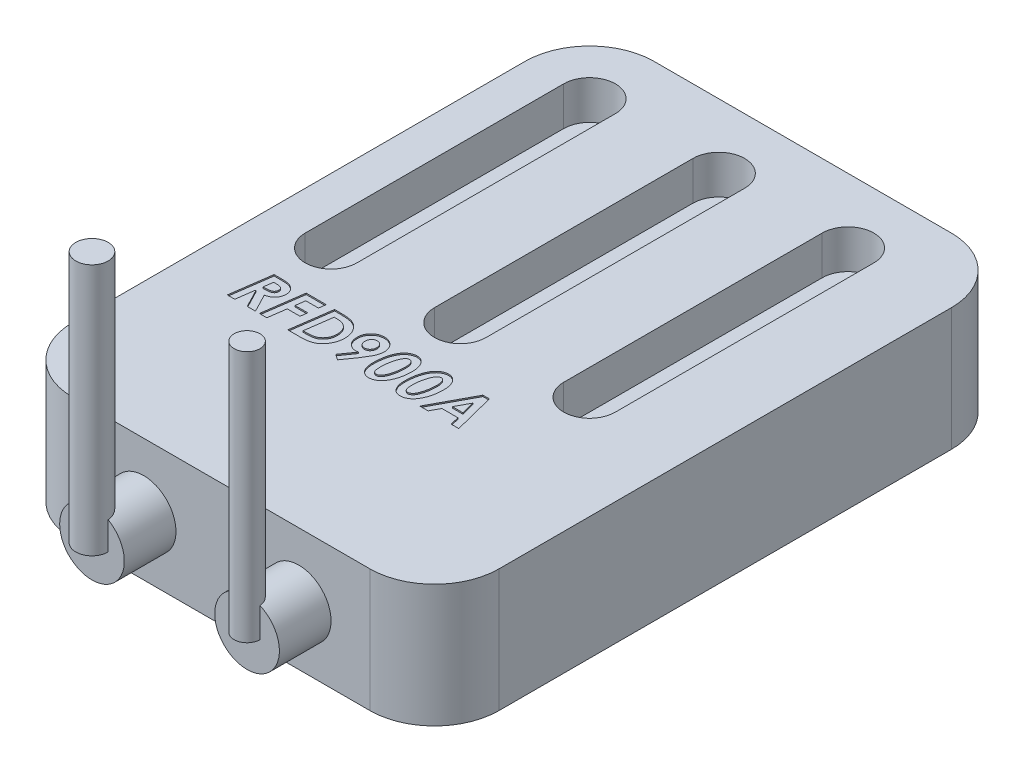
from build123d import *

# Parameters (mm, degrees)
SKETCH1_W           = 33
SKETCH1_H           = 45
BOSS_EXTRUDE1_DEPTH = 9.5
FILLET1_R           = 5
SKETCH2_R           = 2.5
BOSS_EXTRUDE2_DEPTH = 4
CUT_EXTRUDE1_DEPTH  = 3
CUT_EXTRUDE2_DEPTH  = 0.1
SWEEP1_PROFILE_R    = 1.25
SWEEP2_PROFILE_R    = 1


with BuildPart() as part:
    # Sketch1 → Boss-Extrude1 (new body)
    with BuildSketch(Plane(origin=(0, 0, 0), x_dir=(1, 0, 0), z_dir=(0, 1, 0))):
        Rectangle(SKETCH1_W, SKETCH1_H)
    extrude(amount=BOSS_EXTRUDE1_DEPTH)

    # Fillet1
    fillet1_edges = [part.edges().sort_by_distance(p)[0] for p in [
        (16.5, 4.75, 22.5),
        (-16.5, 4.75, 22.5),
        (-16.5, 4.75, -22.5),
        (16.5, 4.75, -22.5),
    ]]
    fillet(fillet1_edges, radius=FILLET1_R)

    # Sketch2 → Boss-Extrude2 (add)
    with BuildSketch(Plane.XY.offset(22.5)):
        with Locations(Location((6, 4.5, 0), (0, 0, 180))):
            Circle(SKETCH2_R)
        with Locations(Location((-6, 4.5, 0), (0, 0, 180))):
            Circle(SKETCH2_R)
    extrude(amount=BOSS_EXTRUDE2_DEPTH)

    # Sketch3 → Cut-Extrude1 (cut)
    with BuildSketch(Plane(origin=(0, 9.5, 0), x_dir=(1, 0, 0), z_dir=(0, 1, 0))):
        with BuildLine():
            Line((-9.5, 17.5), (-9.5, -2.5))
            ThreePointArc((-9.5, -2.5), (-11.5, -4.5), (-13.5, -2.5))
            Line((-13.5, -2.5), (-13.5, 17.5))
            ThreePointArc((-13.5, 17.5), (-11.5, 19.5), (-9.5, 17.5))
        make_face()
        with BuildLine():
            Line((-3.5, 17.5), (-3.5, -2.5))
            ThreePointArc((-3.5, -2.5), (-1.5, -4.5), (0.5, -2.5))
            Line((0.5, -2.5), (0.5, 17.5))
            ThreePointArc((0.5, 17.5), (-1.5, 19.5), (-3.5, 17.5))
        make_face()
        with BuildLine():
            Line((6.5, 17.5), (6.5, -2.5))
            ThreePointArc((6.5, -2.5), (8.5, -4.5), (10.5, -2.5))
            Line((10.5, -2.5), (10.5, 17.5))
            ThreePointArc((10.5, 17.5), (8.5, 19.5), (6.5, 17.5))
        make_face()
    extrude(amount=-CUT_EXTRUDE1_DEPTH, mode=Mode.SUBTRACT)

    # Sketch4 → Cut-Extrude2 (cut)
    # profile 1 of 7: a face of its own
    with BuildSketch(Plane(origin=(0, 9.5, 0), x_dir=(1, 0, 0), z_dir=(0, 1, 0))):
        with BuildLine():
            Line((-11.922359857, -6.486440114), (-11.370932573, -6.486440114))
            add(Edge.make_bspline(
                [(-11.370932573, -6.486440114), (-11.330010708, -6.486607344), (-11.251108431, -6.486929783), (-11.13764439, -6.49151487), (-11.033503704, -6.498432354), (-10.9388102, -6.507561343), (-10.853484818, -6.520227306), (-10.777704999, -6.535435331), (-10.710986719, -6.552371586), (-10.670976001, -6.568109859), (-10.652232653, -6.575482582)],
                knots=[0, 0, 0, 0, 1.348808202, 2.600664361, 3.742342956, 4.788858012, 5.735658768, 6.584006912, 7.336666444, 8, 8, 8, 8], degree=3))
            add(Edge.make_bspline(
                [(-10.652232653, -6.575482582), (-10.631130054, -6.584998846), (-10.589877811, -6.603601637), (-10.530765752, -6.635134509), (-10.47541191, -6.66910397), (-10.424733674, -6.70679078), (-10.377661579, -6.746608069), (-10.334487513, -6.788934552), (-10.295559118, -6.834419809), (-10.260467848, -6.882248003), (-10.229264842, -6.932357274), (-10.202480277, -6.984994725), (-10.179320127, -7.039714713), (-10.16123397, -7.097112688), (-10.146202199, -7.156499652), (-10.136480195, -7.218250296), (-10.129638307, -7.282156324), (-10.129076113, -7.325540164), (-10.128790145, -7.347607982)],
                knots=[0, 0, 0, 0, 1.116361014, 2.182309107, 3.229450697, 4.24598407, 5.225421932, 6.201651319, 7.158895679, 8.110002388, 9.060669178, 10.002827475, 10.956240434, 11.923213192, 12.902917952, 13.908279153, 14.936015885, 16, 16, 16, 16], degree=3))
            add(Edge.make_bspline(
                [(-10.128790145, -7.347607982), (-10.12946267, -7.374763952), (-10.130790343, -7.428374233), (-10.139465636, -7.507429804), (-10.155646136, -7.583291832), (-10.177436389, -7.656199289), (-10.204432763, -7.726624243), (-10.23924812, -7.793341246), (-10.279490342, -7.857512761), (-10.325966003, -7.918297458), (-10.377913743, -7.976252939), (-10.437895183, -8.027968457), (-10.502592063, -8.076922028), (-10.574662225, -8.119831532), (-10.652123559, -8.159690639), (-10.736742849, -8.193461698), (-10.826931924, -8.224627172), (-10.890170859, -8.240225058), (-10.922540145, -8.248208944)],
                knots=[0, 0, 0, 0, 0.995453645, 1.965186658, 2.910129054, 3.83459069, 4.752398018, 5.669942118, 6.588407184, 7.525617038, 8.471772905, 9.435289717, 10.423772802, 11.441988612, 12.505459691, 13.613754905, 14.778583949, 16, 16, 16, 16], degree=3))
            Line((-10.922540145, -8.248208944), (-10.189847838, -9.661440114))
            Line((-10.189847838, -9.661440114), (-10.826501484, -9.661440114))
            Line((-10.826501484, -9.661440114), (-11.543929368, -8.277465755))
            Line((-11.543929368, -8.277465755), (-11.597990867, -8.277465755))
            Line((-11.597990867, -8.277465755), (-11.792612261, -9.661440114))
            Line((-11.792612261, -9.661440114), (-12.367572197, -9.661440114))
            Line((-12.367572197, -9.661440114), (-11.922359857, -6.486440114))
        make_face()
        with BuildLine():
            add(Edge.make_bspline(
                [(-11.523576804, -7.748299088), (-11.482653708, -7.747919095), (-11.404378122, -7.747192265), (-11.292585111, -7.742136628), (-11.191773605, -7.73415056), (-11.102234346, -7.722737946), (-11.023731797, -7.709240955), (-10.956599441, -7.692390924), (-10.900529573, -7.672356545), (-10.85463783, -7.648597772), (-10.817462357, -7.620702654), (-10.785285388, -7.590934192), (-10.758492272, -7.557611694), (-10.73638555, -7.521294575), (-10.719335365, -7.481907561), (-10.707039545, -7.43918381), (-10.700241088, -7.393408187), (-10.699195971, -7.361833738), (-10.69866194, -7.34569993)],
                knots=[0, 0, 0, 0, 1.892208387, 3.619318591, 5.173427176, 6.566868293, 7.791773198, 8.8545744, 9.763297566, 10.539470204, 11.233547833, 11.906251103, 12.5615143, 13.203742025, 13.866659999, 14.539934446, 15.25394049, 16, 16, 16, 16], degree=3))
            add(Edge.make_bspline(
                [(-10.69866194, -7.34569993), (-10.699353222, -7.32740652), (-10.700694214, -7.291919814), (-10.712293245, -7.240808723), (-10.732127189, -7.194444022), (-10.760001095, -7.153268977), (-10.79478623, -7.116962861), (-10.837222189, -7.087060587), (-10.886824069, -7.063521744), (-10.933289199, -7.047970344), (-10.97727088, -7.038962574), (-11.018270281, -7.03291056), (-11.066812427, -7.027070582), (-11.123043329, -7.022752102), (-11.186895392, -7.019895508), (-11.258336106, -7.017119713), (-11.337221346, -7.016132624), (-11.39234531, -7.015787367), (-11.421177966, -7.01560678)],
                knots=[0, 0, 0, 0, 0.974340854, 1.890087692, 2.776057671, 3.647490651, 4.526730822, 5.442477659, 6.397820337, 7.445016909, 8.045730266, 8.789007992, 9.653967296, 10.651691253, 11.794598421, 13.061237498, 14.462876682, 16, 16, 16, 16], degree=3))
            Line((-11.421177966, -7.01560678), (-11.523576804, -7.748299088))
        make_face(mode=Mode.SUBTRACT)
    # profile 2 of 7: a face of its own
    with BuildSketch(Plane(origin=(0, 9.5, 0), x_dir=(1, 0, 0), z_dir=(0, 1, 0))):
        Polygon((-9.439347036, -6.486440114), (-7.890008094, -6.486440114), (-7.959334016, -7.01560678), (-8.938165145, -7.01560678), (-9.041200001, -7.748299088), (-8.05473666, -7.748299088), (-8.124062581, -8.277465755), (-9.114978046, -8.277465755), (-9.30959944, -9.661440114), (-9.884559376, -9.661440114), align=None)
    # profile 3 of 7: a face of its own
    with BuildSketch(Plane(origin=(0, 9.5, 0), x_dir=(1, 0, 0), z_dir=(0, 1, 0))):
        with BuildLine():
            Line((-7.241270113, -6.486440114), (-6.740088222, -6.486440114))
            add(Edge.make_bspline(
                [(-6.740088222, -6.486440114), (-6.683262698, -6.486909443), (-6.573373167, -6.487817034), (-6.414014068, -6.49530035), (-6.266114975, -6.508508655), (-6.129405265, -6.526789867), (-6.003873825, -6.550113444), (-5.88947271, -6.578355357), (-5.7860879, -6.611766449), (-5.693431313, -6.65191078), (-5.608116558, -6.696958499), (-5.528164918, -6.74836012), (-5.452199352, -6.805473692), (-5.379707582, -6.867937833), (-5.312159043, -6.937124595), (-5.248603147, -7.012304714), (-5.18879662, -7.093315214), (-5.132941226, -7.179315092), (-5.082698791, -7.27024386), (-5.038808147, -7.365282468), (-5.001125324, -7.463529598), (-4.971320338, -7.565524573), (-4.947758606, -7.670689068), (-4.930630637, -7.779433046), (-4.920175134, -7.891620208), (-4.919085278, -7.967490558), (-4.918533735, -8.005886228)],
                knots=[0, 0, 0, 0, 1.508928034, 2.917973822, 4.235011166, 5.450779055, 6.579221784, 7.623755204, 8.577985451, 9.460610614, 10.301756591, 11.137250569, 11.981705789, 12.823774396, 13.675702816, 14.546470419, 15.435981066, 16.347923198, 17.267651715, 18.192054867, 19.125737078, 20.059147693, 21.011116727, 21.985721956, 22.980635317, 24, 24, 24, 24], degree=3))
            add(Edge.make_bspline(
                [(-4.918533735, -8.005886228), (-4.919308689, -8.045555112), (-4.920849017, -8.12440256), (-4.93190154, -8.241244554), (-4.949775687, -8.355720348), (-4.974413313, -8.467790161), (-5.006861897, -8.577498694), (-5.047377488, -8.684267914), (-5.093510034, -8.789165744), (-5.147721737, -8.890034876), (-5.206185655, -8.986884778), (-5.269483358, -9.07744324), (-5.335872266, -9.161612524), (-5.407021726, -9.23823792), (-5.48156506, -9.308411374), (-5.559529948, -9.372131267), (-5.641757461, -9.428513711), (-5.728155108, -9.47856039), (-5.821023094, -9.522430382), (-5.921783128, -9.559594577), (-6.030744878, -9.591536386), (-6.148429872, -9.616472496), (-6.274276715, -9.636829188), (-6.408644298, -9.651409552), (-6.551517328, -9.659391405), (-6.649552111, -9.660743878), (-6.700019112, -9.661440114)],
                knots=[0, 0, 0, 0, 1.035326767, 2.057856534, 3.060426681, 4.057975219, 5.050723532, 6.043595218, 7.036960241, 8.039530388, 9.030318104, 9.988216712, 10.921569661, 11.826132526, 12.714780289, 13.59198308, 14.451536877, 15.31430869, 16.195534129, 17.128821459, 18.114698389, 19.15667332, 20.266554844, 21.441073174, 22.682698532, 24, 24, 24, 24], degree=3))
            Line((-6.700019112, -9.661440114), (-7.686482453, -9.661440114))
            Line((-7.686482453, -9.661440114), (-7.241270113, -6.486440114))
        make_face()
        with BuildLine():
            Line((-6.74072424, -7.01560678), (-7.037108455, -9.132273447))
            Line((-7.037108455, -9.132273447), (-6.831674761, -9.132273447))
            add(Edge.make_bspline(
                [(-6.831674761, -9.132273447), (-6.793508391, -9.132077968), (-6.720123338, -9.131702108), (-6.614116308, -9.127494359), (-6.516258504, -9.122485162), (-6.426600535, -9.113183734), (-6.344814801, -9.102833766), (-6.271456874, -9.089349618), (-6.205683013, -9.074855983), (-6.165665734, -9.061170788), (-6.146683775, -9.054679297)],
                knots=[0, 0, 0, 0, 1.323091274, 2.54399687, 3.677836413, 4.719289959, 5.668358043, 6.534823038, 7.305002022, 8, 8, 8, 8], degree=3))
            add(Edge.make_bspline(
                [(-6.146683775, -9.054679297), (-6.122294141, -9.045199871), (-6.073841886, -9.026368119), (-6.005510827, -8.989736629), (-5.939212484, -8.950911594), (-5.877845941, -8.905244249), (-5.819235911, -8.855671263), (-5.76572708, -8.800074673), (-5.714721706, -8.74049934), (-5.668027502, -8.675797795), (-5.625339877, -8.607007814), (-5.588987252, -8.533591363), (-5.557597653, -8.456523968), (-5.532462587, -8.375168744), (-5.512547174, -8.290168032), (-5.498941307, -8.201269457), (-5.489442249, -8.108490831), (-5.48875523, -8.045132461), (-5.48840553, -8.012882422)],
                knots=[0, 0, 0, 0, 0.952655881, 1.892538673, 2.821337892, 3.750040712, 4.676008024, 5.615700279, 6.558436491, 7.532008524, 8.520486916, 9.505184105, 10.513747313, 11.549809891, 12.604882282, 13.692134403, 14.825273528, 16, 16, 16, 16], degree=3))
            add(Edge.make_bspline(
                [(-5.48840553, -8.012882422), (-5.488770964, -7.986373171), (-5.489485185, -7.934562326), (-5.495097285, -7.858488678), (-5.505499169, -7.785700716), (-5.51911323, -7.716157753), (-5.537207406, -7.649920542), (-5.558768842, -7.58700293), (-5.58388736, -7.526949359), (-5.624087681, -7.452874052), (-5.681390003, -7.366451282), (-5.765096667, -7.27510514), (-5.862370664, -7.197071176), (-5.953040004, -7.142538419), (-6.032168051, -7.105224283), (-6.097153332, -7.081331213), (-6.166827092, -7.060820777), (-6.241309921, -7.044758969), (-6.320162945, -7.030959179), (-6.403925248, -7.022685089), (-6.492374447, -7.016556537), (-6.553087045, -7.01592902), (-6.584263903, -7.01560678)],
                knots=[0, 0, 0, 0, 0.941373656, 1.839862062, 2.706559874, 3.551131217, 4.354742518, 5.142827075, 5.911946928, 6.663057697, 8.133107042, 9.582556681, 11.0440985, 12.547036792, 13.328439944, 14.147940985, 15.003216405, 15.905576335, 16.852443473, 17.844335315, 18.893032825, 20, 20, 20, 20], degree=3))
            Line((-6.584263903, -7.01560678), (-6.74072424, -7.01560678))
        make_face(mode=Mode.SUBTRACT)
    # profile 4 of 7: a face of its own
    with BuildSketch(Plane(origin=(0, 9.5, 0), x_dir=(1, 0, 0), z_dir=(0, 1, 0))):
        with BuildLine():
            Line((-3.75080537, -9.74285037), (-4.191565586, -9.447738191))
            Line((-4.191565586, -9.447738191), (-3.458237261, -8.411029457))
            add(Edge.make_bspline(
                [(-3.458237261, -8.411029457), (-3.493266951, -8.419386419), (-3.559199222, -8.435115749), (-3.626866862, -8.438636217), (-3.658582814, -8.440286268)],
                knots=[0, 0, 0, 0, 1.062596194, 2, 2, 2, 2], degree=3))
            add(Edge.make_bspline(
                [(-3.658582814, -8.440286268), (-3.687459781, -8.439395537), (-3.744437166, -8.437638029), (-3.82832208, -8.424731661), (-3.908837009, -8.402894758), (-3.986406032, -8.372963625), (-4.060615129, -8.333824537), (-4.131374479, -8.285737217), (-4.198966317, -8.229379848), (-4.262998439, -8.165613992), (-4.320746785, -8.094823517), (-4.372337555, -8.019643015), (-4.414649555, -7.939477625), (-4.450713288, -7.856130884), (-4.478271769, -7.768318654), (-4.496786781, -7.676181437), (-4.509607076, -7.580112279), (-4.510850728, -7.51450005), (-4.511482453, -7.481171684)],
                knots=[0, 0, 0, 0, 0.969934056, 1.913784993, 2.843311147, 3.767857612, 4.701332088, 5.655473226, 6.636716954, 7.654054707, 8.686390878, 9.701782049, 10.711913777, 11.726630261, 12.749339213, 13.796991767, 14.880960657, 16, 16, 16, 16], degree=3))
            add(Edge.make_bspline(
                [(-4.511482453, -7.481171684), (-4.51070133, -7.443602701), (-4.509164309, -7.369678039), (-4.494810076, -7.261058713), (-4.471286935, -7.157198168), (-4.438975248, -7.057945299), (-4.396642313, -6.964111021), (-4.345455461, -6.87494573), (-4.284578292, -6.790681046), (-4.215224333, -6.711780309), (-4.13837761, -6.640190574), (-4.05636692, -6.576700526), (-3.968394794, -6.523493632), (-3.875303385, -6.480325817), (-3.777112129, -6.446262036), (-3.673966209, -6.422197186), (-3.565476784, -6.408116059), (-3.491563682, -6.406073733), (-3.453785137, -6.405029857)],
                knots=[0, 0, 0, 0, 1.067153374, 2.099842657, 3.106801845, 4.089832761, 5.060584944, 6.026765153, 7.006523203, 8.009636506, 9.007035051, 9.986663441, 10.951659663, 11.921944397, 12.897414564, 13.899858298, 14.926573288, 16, 16, 16, 16], degree=3))
            add(Edge.make_bspline(
                [(-3.453785137, -6.405029857), (-3.419385172, -6.405778731), (-3.351772771, -6.407250627), (-3.253042782, -6.421980166), (-3.158493098, -6.443913367), (-3.0684287, -6.475840041), (-2.982857171, -6.517509008), (-2.901650083, -6.56803113), (-2.825009214, -6.627579047), (-2.753527703, -6.695403931), (-2.688625972, -6.769758009), (-2.631584625, -6.848894024), (-2.583670824, -6.932303205), (-2.543615357, -7.019569645), (-2.514401945, -7.111867765), (-2.491484763, -7.207378192), (-2.478902436, -7.307415566), (-2.47712901, -7.375348592), (-2.476226043, -7.40993771)],
                knots=[0, 0, 0, 0, 1.054208263, 2.072023952, 3.054444288, 4.027070767, 4.995341725, 5.967729158, 6.954763786, 7.966519073, 8.984832979, 9.977163491, 10.952913907, 11.930568481, 12.915373779, 13.916778088, 14.939296369, 16, 16, 16, 16], degree=3))
            add(Edge.make_bspline(
                [(-2.476226043, -7.40993771), (-2.476665446, -7.437943115), (-2.477539555, -7.493654445), (-2.486073756, -7.576334041), (-2.500032442, -7.657704721), (-2.513407438, -7.710849525), (-2.520111259, -7.737486789)],
                knots=[0, 0, 0, 0, 1.013662365, 2.016484985, 3.005821674, 4, 4, 4, 4], degree=3))
            add(Edge.make_bspline(
                [(-2.520111259, -7.737486789), (-2.531722746, -7.775174852), (-2.554918824, -7.850463681), (-2.598170806, -7.960383663), (-2.646130137, -8.068234319), (-2.68295082, -8.137740973), (-2.701376283, -8.172522846)],
                knots=[0, 0, 0, 0, 1.00191864, 2.001516544, 2.999937518, 4, 4, 4, 4], degree=3))
            add(Edge.make_bspline(
                [(-2.701376283, -8.172522846), (-2.73387476, -8.2314563), (-2.797733156, -8.347258525), (-2.898360833, -8.514922961), (-2.999235134, -8.675105676), (-3.069911881, -8.777398929), (-3.10461146, -8.827621003)],
                knots=[0, 0, 0, 0, 1.049210121, 2.061662041, 3.048350216, 4, 4, 4, 4], degree=3))
            Line((-3.10461146, -8.827621003), (-3.75080537, -9.74285037))
        make_face()
        with BuildLine():
            add(Edge.make_bspline(
                [(-3.513570794, -7.911119601), (-3.497854168, -7.910597853), (-3.466690803, -7.909563316), (-3.420898268, -7.902310836), (-3.376555308, -7.891185198), (-3.334560879, -7.873936319), (-3.293161879, -7.854115845), (-3.254848749, -7.827404765), (-3.217293684, -7.797583105), (-3.182943441, -7.762492561), (-3.150627588, -7.724971128), (-3.122530925, -7.684686862), (-3.098792122, -7.642543318), (-3.0797877, -7.598299623), (-3.064399565, -7.552619404), (-3.053498355, -7.504916777), (-3.047052012, -7.455487628), (-3.046417785, -7.42182916), (-3.046097838, -7.404849569)],
                knots=[0, 0, 0, 0, 0.985080672, 1.953245337, 2.901122396, 3.844046743, 4.795180322, 5.772156162, 6.764474587, 7.798388123, 8.845124698, 9.866573221, 10.872333035, 11.872455336, 12.881284841, 13.890552111, 14.935852891, 16, 16, 16, 16], degree=3))
            add(Edge.make_bspline(
                [(-3.046097838, -7.404849569), (-3.047425928, -7.372895227), (-3.050014988, -7.310601503), (-3.074293259, -7.221260058), (-3.114488039, -7.140047542), (-3.160729973, -7.080369814), (-3.203769853, -7.038309669), (-3.237735041, -7.010138541), (-3.274336197, -6.987062126), (-3.311907832, -6.967117478), (-3.352245274, -6.952504415), (-3.393955736, -6.941707058), (-3.437674767, -6.935102413), (-3.467330641, -6.934501826), (-3.482405931, -6.934196524)],
                knots=[0, 0, 0, 0, 1.60545481, 3.129770537, 4.618423052, 6.139935935, 6.901925764, 7.64508505, 8.355351643, 9.075880782, 9.781403904, 10.508537769, 11.241828942, 12, 12, 12, 12], degree=3))
            add(Edge.make_bspline(
                [(-3.482405931, -6.934196524), (-3.498333145, -6.934713482), (-3.529705948, -6.935731766), (-3.575738826, -6.942951873), (-3.619702229, -6.954259556), (-3.661788254, -6.970398843), (-3.70175908, -6.99153652), (-3.740071842, -7.016915127), (-3.776100036, -7.047442909), (-3.80990755, -7.081966661), (-3.840922221, -7.119765952), (-3.867855545, -7.160303571), (-3.89086247, -7.202805068), (-3.909166333, -7.247694196), (-3.924203257, -7.294378361), (-3.933934739, -7.343480804), (-3.940776608, -7.394692814), (-3.941328807, -7.429630135), (-3.941610658, -7.44746275)],
                knots=[0, 0, 0, 0, 0.995464246, 1.960826493, 2.905959859, 3.828995532, 4.771616354, 5.727377317, 6.696372172, 7.717963959, 8.744701472, 9.748250483, 10.756340463, 11.760589422, 12.775019926, 13.817379281, 14.885952523, 16, 16, 16, 16], degree=3))
            add(Edge.make_bspline(
                [(-3.941610658, -7.44746275), (-3.940262562, -7.478998213), (-3.937637199, -7.54041222), (-3.913695634, -7.628329159), (-3.876064118, -7.708878081), (-3.831204417, -7.767869223), (-3.789066392, -7.80871936), (-3.755983099, -7.836715395), (-3.720183971, -7.859598599), (-3.682467906, -7.877929567), (-3.643149687, -7.892896667), (-3.601815768, -7.903661265), (-3.558302411, -7.910208083), (-3.528646237, -7.910812401), (-3.513570794, -7.911119601)],
                knots=[0, 0, 0, 0, 1.608637365, 3.132754666, 4.62043579, 6.128489542, 6.886920241, 7.617928657, 8.339158067, 9.051380967, 9.757646507, 10.485517361, 11.23012673, 12, 12, 12, 12], degree=3))
        make_face(mode=Mode.SUBTRACT)
    # profile 5 of 7: a face of its own
    with BuildSketch(Plane(origin=(0, 9.5, 0), x_dir=(1, 0, 0), z_dir=(0, 1, 0))):
        with BuildLine():
            add(Edge.make_bspline(
                [(-0.926887101, -6.405029857), (-0.897131454, -6.405952377), (-0.838489327, -6.407770468), (-0.752747586, -6.423846066), (-0.670355183, -6.448196091), (-0.592454371, -6.484815384), (-0.517258732, -6.529668796), (-0.447333285, -6.586813665), (-0.380117445, -6.652497203), (-0.317331738, -6.72826037), (-0.259748578, -6.813541973), (-0.210380212, -6.909182551), (-0.167598459, -7.01356066), (-0.133640127, -7.127428116), (-0.106868923, -7.250313354), (-0.088277888, -7.382548129), (-0.07664015, -7.523999686), (-0.075308615, -7.62128379), (-0.074623479, -7.671340955)],
                knots=[0, 0, 0, 0, 0.836471817, 1.648510141, 2.446693269, 3.247435573, 4.063800371, 4.904091908, 5.781463953, 6.704836402, 7.667709944, 8.670923685, 9.727683881, 10.837250621, 12.009625467, 13.263198326, 14.591789123, 16, 16, 16, 16], degree=3))
            add(Edge.make_bspline(
                [(-0.074623479, -7.671340955), (-0.075274601, -7.723718326), (-0.076559339, -7.827064762), (-0.085544495, -7.980075566), (-0.100689062, -8.128850023), (-0.122208198, -8.273416346), (-0.150354413, -8.413426939), (-0.183911988, -8.549372709), (-0.224027081, -8.680931801), (-0.269671705, -8.807567764), (-0.319343389, -8.927589752), (-0.372895028, -9.039474035), (-0.429564645, -9.142200579), (-0.487669358, -9.237267776), (-0.550255382, -9.322202004), (-0.61465362, -9.399273504), (-0.681778049, -9.467782746), (-0.753015454, -9.526260776), (-0.825567659, -9.577091008), (-0.899240437, -9.621466049), (-0.974230397, -9.659071052), (-1.050791236, -9.68982669), (-1.128577299, -9.713186318), (-1.207372103, -9.730715666), (-1.287649489, -9.741151604), (-1.341752639, -9.74228251), (-1.368919352, -9.74285037)],
                knots=[0, 0, 0, 0, 1.396844559, 2.756131219, 4.086127259, 5.383920942, 6.652453196, 7.89349539, 9.116895717, 10.318757433, 11.482194025, 12.579741648, 13.624829685, 14.610133714, 15.548779577, 16.435605836, 17.287197802, 18.102347136, 18.889788549, 19.648068299, 20.394000194, 21.124756219, 21.84557971, 22.557590164, 23.275725456, 24, 24, 24, 24], degree=3))
            add(Edge.make_bspline(
                [(-1.368919352, -9.74285037), (-1.407005185, -9.741299184), (-1.48164311, -9.738259278), (-1.590502285, -9.713045959), (-1.692909936, -9.672252402), (-1.772241283, -9.624700187), (-1.831591181, -9.579122329), (-1.873772345, -9.540068162), (-1.915053241, -9.498393471), (-1.952532113, -9.451292655), (-1.987806689, -9.400488228), (-2.021993768, -9.346286512), (-2.052905158, -9.287683311), (-2.081596174, -9.225065491), (-2.108047575, -9.15820167), (-2.129911008, -9.085976639), (-2.149278473, -9.008999941), (-2.163819185, -8.926853767), (-2.177272559, -8.840243461), (-2.184830615, -8.748436292), (-2.190149792, -8.651931424), (-2.190904517, -8.585942567), (-2.191290145, -8.55222537)],
                knots=[0, 0, 0, 0, 1.406247179, 2.755863859, 4.106117258, 5.46602111, 6.158742467, 6.868709005, 7.589063128, 8.324514997, 9.089670002, 9.87455016, 10.69128516, 11.536247762, 12.419471489, 13.346380782, 14.323181077, 15.351303999, 16.428392134, 17.561291642, 18.753934945, 20, 20, 20, 20], degree=3))
            add(Edge.make_bspline(
                [(-2.191290145, -8.55222537), (-2.190636587, -8.495184764), (-2.18934568, -8.382518231), (-2.180393571, -8.215952232), (-2.165313499, -8.054240672), (-2.143498522, -7.897699209), (-2.116517095, -7.746059582), (-2.082486273, -7.599742322), (-2.043600294, -7.457914082), (-2.011801431, -7.366317136), (-1.996032734, -7.320895242)],
                knots=[0, 0, 0, 0, 1.092573637, 2.158050095, 3.194115651, 4.202596009, 5.184740479, 6.143227219, 7.07924729, 8, 8, 8, 8], degree=3))
            add(Edge.make_bspline(
                [(-1.996032734, -7.320895242), (-1.981213999, -7.282547297), (-1.952237087, -7.2075608), (-1.902257498, -7.100763796), (-1.849797319, -7.001381093), (-1.793806671, -6.910164502), (-1.734507077, -6.826890812), (-1.67161357, -6.751763678), (-1.605157535, -6.684377613), (-1.535237596, -6.625392489), (-1.462939087, -6.573966989), (-1.390071432, -6.528283812), (-1.315062863, -6.490865348), (-1.239504876, -6.459486693), (-1.16290683, -6.435118837), (-1.085194597, -6.418063019), (-1.006523454, -6.406534406), (-0.953428313, -6.405531293), (-0.926887101, -6.405029857)],
                knots=[0, 0, 0, 0, 1.312439913, 2.566376662, 3.7626465, 4.899353607, 5.981447343, 7.024199363, 8.024692673, 8.999854102, 9.941079975, 10.856034809, 11.7431154, 12.614348406, 13.466487218, 14.305782657, 15.153094213, 16, 16, 16, 16], degree=3))
        make_face()
        with BuildLine():
            add(Edge.make_bspline(
                [(-0.98603674, -6.934196524), (-1.006783037, -6.935552917), (-1.048701213, -6.938293528), (-1.109618814, -6.96083896), (-1.168127681, -6.996571726), (-1.202221151, -7.02909078), (-1.220091227, -7.046135627)],
                knots=[0, 0, 0, 0, 0.932167559, 1.883457255, 2.89061511, 4, 4, 4, 4], degree=3))
            add(Edge.make_bspline(
                [(-1.220091227, -7.046135627), (-1.233380805, -7.061122234), (-1.261357913, -7.092671915), (-1.297900398, -7.148117808), (-1.335477774, -7.210395603), (-1.369779201, -7.2821841), (-1.404080257, -7.361759256), (-1.43811893, -7.449576959), (-1.469121481, -7.546312658), (-1.51121551, -7.685584577), (-1.555329614, -7.867571952), (-1.59350301, -8.091740434), (-1.617073809, -8.320208516), (-1.619964335, -8.474151643), (-1.621418351, -8.551589353)],
                knots=[0, 0, 0, 0, 0.454841493, 0.957528522, 1.506411314, 2.107825232, 2.764136245, 3.476658851, 4.247912131, 5.07291354, 6.784378205, 8.500722671, 10.239765365, 12, 12, 12, 12], degree=3))
            add(Edge.make_bspline(
                [(-1.621418351, -8.551589353), (-1.62116606, -8.582543779), (-1.620682003, -8.641934229), (-1.617269143, -8.727057234), (-1.609824291, -8.804419091), (-1.601663761, -8.874193984), (-1.589605701, -8.936028561), (-1.574960494, -8.990030681), (-1.558366882, -9.036547882), (-1.538168457, -9.075698925), (-1.515794487, -9.108505503), (-1.490934692, -9.13638428), (-1.46479641, -9.160508228), (-1.435981253, -9.179959867), (-1.405776856, -9.19548009), (-1.37294296, -9.205291756), (-1.338750954, -9.213038533), (-1.314905565, -9.213466144), (-1.302773519, -9.213683704)],
                knots=[0, 0, 0, 0, 1.809169144, 3.47114723, 4.976568932, 6.350508084, 7.575216927, 8.654321082, 9.618705548, 10.455493865, 11.22189838, 11.932917759, 12.63470061, 13.29454068, 13.959479695, 14.609946561, 15.292769288, 16, 16, 16, 16], degree=3))
            add(Edge.make_bspline(
                [(-1.302773519, -9.213683704), (-1.27984784, -9.211858219), (-1.232303859, -9.208072474), (-1.161875014, -9.178705248), (-1.091946949, -9.13233924), (-1.034023882, -9.081148619), (-0.98756762, -9.029682686), (-0.953684394, -8.980052562), (-0.920000596, -8.922323074), (-0.886204385, -8.856563401), (-0.854896588, -8.78131973), (-0.822953036, -8.698082118), (-0.791979587, -8.605994008), (-0.751911644, -8.470656435), (-0.707793427, -8.291064557), (-0.671661533, -8.065170431), (-0.648796892, -7.829545263), (-0.645946141, -7.669062858), (-0.644495274, -7.587386628)],
                knots=[0, 0, 0, 0, 0.585084729, 1.213366824, 1.923217654, 2.726038827, 3.183054462, 3.692969635, 4.259263019, 4.892137045, 5.581993971, 6.3422359, 7.172083011, 8.065836625, 9.951587279, 11.896519821, 13.911566738, 16, 16, 16, 16], degree=3))
            add(Edge.make_bspline(
                [(-0.644495274, -7.587386628), (-0.644686785, -7.55918551), (-0.645057113, -7.504652737), (-0.649351422, -7.426097747), (-0.657268298, -7.353798157), (-0.666627547, -7.287513131), (-0.681241827, -7.227883329), (-0.696313769, -7.173814973), (-0.716275429, -7.126695005), (-0.738622636, -7.085311867), (-0.763583968, -7.049835148), (-0.789555942, -7.018684486), (-0.818162656, -6.993094731), (-0.847838655, -6.971107486), (-0.880022502, -6.954326975), (-0.914005863, -6.943071764), (-0.949470683, -6.935698815), (-0.973703192, -6.934703239), (-0.98603674, -6.934196524)],
                knots=[0, 0, 0, 0, 1.651300251, 3.193135231, 4.60384893, 5.910135154, 7.108621979, 8.196635245, 9.19265296, 10.098222774, 10.945408105, 11.729089381, 12.467301952, 13.187443458, 13.887068836, 14.581941946, 15.278255209, 16, 16, 16, 16], degree=3))
        make_face(mode=Mode.SUBTRACT)
    # profile 6 of 7: a face of its own
    with BuildSketch(Plane(origin=(0, 9.5, 0), x_dir=(1, 0, 0), z_dir=(0, 1, 0))):
        with BuildLine():
            add(Edge.make_bspline(
                [(1.515420592, -6.405029857), (1.545176239, -6.405952377), (1.603818365, -6.407770468), (1.689560106, -6.423846066), (1.771952509, -6.448196091), (1.849853322, -6.484815384), (1.92504896, -6.529668796), (1.994974407, -6.586813665), (2.062190247, -6.652497203), (2.124975954, -6.72826037), (2.182559115, -6.813541973), (2.231927481, -6.909182551), (2.274709233, -7.01356066), (2.308667566, -7.127428116), (2.33543877, -7.250313354), (2.354029804, -7.382548129), (2.365667542, -7.523999686), (2.366999077, -7.62128379), (2.367684214, -7.671340955)],
                knots=[0, 0, 0, 0, 0.836471817, 1.648510141, 2.446693269, 3.247435573, 4.063800371, 4.904091908, 5.781463953, 6.704836402, 7.667709944, 8.670923685, 9.727683881, 10.837250621, 12.009625467, 13.263198326, 14.591789123, 16, 16, 16, 16], degree=3))
            add(Edge.make_bspline(
                [(2.367684214, -7.671340955), (2.367033091, -7.723718326), (2.365748353, -7.827064762), (2.356763198, -7.980075566), (2.34161863, -8.128850023), (2.320099494, -8.273416346), (2.291953279, -8.413426939), (2.258395705, -8.549372709), (2.218280611, -8.680931801), (2.172635987, -8.807567764), (2.122964303, -8.927589752), (2.069412664, -9.039474035), (2.012743047, -9.142200579), (1.954638334, -9.237267776), (1.89205231, -9.322202004), (1.827654072, -9.399273504), (1.760529643, -9.467782746), (1.689292238, -9.526260776), (1.616740033, -9.577091008), (1.543067255, -9.621466049), (1.468077295, -9.659071052), (1.391516456, -9.68982669), (1.313730393, -9.713186318), (1.234935589, -9.730715666), (1.154658203, -9.741151604), (1.100555053, -9.74228251), (1.07338834, -9.74285037)],
                knots=[0, 0, 0, 0, 1.396844559, 2.756131219, 4.086127259, 5.383920942, 6.652453196, 7.89349539, 9.116895717, 10.318757433, 11.482194025, 12.579741648, 13.624829685, 14.610133714, 15.548779577, 16.435605836, 17.287197802, 18.102347136, 18.889788549, 19.648068299, 20.394000194, 21.124756219, 21.84557971, 22.557590164, 23.275725456, 24, 24, 24, 24], degree=3))
            add(Edge.make_bspline(
                [(1.07338834, -9.74285037), (1.035302507, -9.741299184), (0.960664582, -9.738259278), (0.851805407, -9.713045959), (0.749397756, -9.672252402), (0.670066409, -9.624700187), (0.610716511, -9.579122329), (0.568535347, -9.540068162), (0.527254451, -9.498393471), (0.489775579, -9.451292655), (0.454501003, -9.400488228), (0.420313924, -9.346286512), (0.389402534, -9.287683311), (0.360711519, -9.225065491), (0.334260118, -9.15820167), (0.312396685, -9.085976639), (0.293029219, -9.008999941), (0.278488507, -8.926853767), (0.265035133, -8.840243461), (0.257477078, -8.748436292), (0.2521579, -8.651931424), (0.251403175, -8.585942567), (0.251017547, -8.55222537)],
                knots=[0, 0, 0, 0, 1.406247179, 2.755863859, 4.106117258, 5.46602111, 6.158742467, 6.868709005, 7.589063128, 8.324514997, 9.089670002, 9.87455016, 10.69128516, 11.536247762, 12.419471489, 13.346380782, 14.323181077, 15.351303999, 16.428392134, 17.561291642, 18.753934945, 20, 20, 20, 20], degree=3))
            add(Edge.make_bspline(
                [(0.251017547, -8.55222537), (0.251671105, -8.495184764), (0.252962012, -8.382518231), (0.261914121, -8.215952232), (0.276994193, -8.054240672), (0.29880917, -7.897699209), (0.325790598, -7.746059582), (0.359821419, -7.599742322), (0.398707398, -7.457914082), (0.430506261, -7.366317136), (0.446274959, -7.320895242)],
                knots=[0, 0, 0, 0, 1.092573637, 2.158050095, 3.194115651, 4.202596009, 5.184740479, 6.143227219, 7.07924729, 8, 8, 8, 8], degree=3))
            add(Edge.make_bspline(
                [(0.446274959, -7.320895242), (0.461093694, -7.282547297), (0.490070605, -7.2075608), (0.540050194, -7.100763796), (0.592510373, -7.001381093), (0.648501022, -6.910164502), (0.707800615, -6.826890812), (0.770694123, -6.751763678), (0.837150157, -6.684377613), (0.907070096, -6.625392489), (0.979368606, -6.573966989), (1.05223626, -6.528283812), (1.127244829, -6.490865348), (1.202802816, -6.459486693), (1.279400862, -6.435118837), (1.357113095, -6.418063019), (1.435784238, -6.406534406), (1.488879379, -6.405531293), (1.515420592, -6.405029857)],
                knots=[0, 0, 0, 0, 1.312439913, 2.566376662, 3.7626465, 4.899353607, 5.981447343, 7.024199363, 8.024692673, 8.999854102, 9.941079975, 10.856034809, 11.7431154, 12.614348406, 13.466487218, 14.305782657, 15.153094213, 16, 16, 16, 16], degree=3))
        make_face()
        with BuildLine():
            add(Edge.make_bspline(
                [(1.456270952, -6.934196524), (1.435524655, -6.935552917), (1.393606479, -6.938293528), (1.332688878, -6.96083896), (1.274180012, -6.996571726), (1.240086542, -7.02909078), (1.222216465, -7.046135627)],
                knots=[0, 0, 0, 0, 0.932167559, 1.883457255, 2.89061511, 4, 4, 4, 4], degree=3))
            add(Edge.make_bspline(
                [(1.222216465, -7.046135627), (1.208926887, -7.061122234), (1.180949779, -7.092671915), (1.144407294, -7.148117808), (1.106829918, -7.210395603), (1.072528491, -7.2821841), (1.038227436, -7.361759256), (1.004188763, -7.449576959), (0.973186211, -7.546312658), (0.931092182, -7.685584577), (0.886978078, -7.867571952), (0.848804682, -8.091740434), (0.825233884, -8.320208516), (0.822343357, -8.474151643), (0.820889342, -8.551589353)],
                knots=[0, 0, 0, 0, 0.454841493, 0.957528522, 1.506411314, 2.107825232, 2.764136245, 3.476658851, 4.247912131, 5.07291354, 6.784378205, 8.500722671, 10.239765365, 12, 12, 12, 12], degree=3))
            add(Edge.make_bspline(
                [(0.820889342, -8.551589353), (0.821141633, -8.582543779), (0.821625689, -8.641934229), (0.825038549, -8.727057234), (0.832483401, -8.804419091), (0.840643931, -8.874193984), (0.852701992, -8.936028561), (0.867347198, -8.990030681), (0.883940811, -9.036547882), (0.904139235, -9.075698925), (0.926513205, -9.108505503), (0.951373001, -9.13638428), (0.977511283, -9.160508228), (1.00632644, -9.179959867), (1.036530836, -9.19548009), (1.069364733, -9.205291756), (1.103556738, -9.213038533), (1.127402128, -9.213466144), (1.139534173, -9.213683704)],
                knots=[0, 0, 0, 0, 1.809169144, 3.47114723, 4.976568932, 6.350508084, 7.575216927, 8.654321082, 9.618705548, 10.455493865, 11.22189838, 11.932917759, 12.63470061, 13.29454068, 13.959479695, 14.609946561, 15.292769288, 16, 16, 16, 16], degree=3))
            add(Edge.make_bspline(
                [(1.139534173, -9.213683704), (1.162459852, -9.211858219), (1.210003833, -9.208072474), (1.280432678, -9.178705248), (1.350360743, -9.13233924), (1.40828381, -9.081148619), (1.454740073, -9.029682686), (1.488623298, -8.980052562), (1.522307097, -8.922323074), (1.556103308, -8.856563401), (1.587411105, -8.78131973), (1.619354657, -8.698082118), (1.650328105, -8.605994008), (1.690396048, -8.470656435), (1.734514266, -8.291064557), (1.77064616, -8.065170431), (1.7935108, -7.829545263), (1.796361552, -7.669062858), (1.797812419, -7.587386628)],
                knots=[0, 0, 0, 0, 0.585084729, 1.213366824, 1.923217654, 2.726038827, 3.183054462, 3.692969635, 4.259263019, 4.892137045, 5.581993971, 6.3422359, 7.172083011, 8.065836625, 9.951587279, 11.896519821, 13.911566738, 16, 16, 16, 16], degree=3))
            add(Edge.make_bspline(
                [(1.797812419, -7.587386628), (1.797620907, -7.55918551), (1.797250579, -7.504652737), (1.792956271, -7.426097747), (1.785039394, -7.353798157), (1.775680146, -7.287513131), (1.761065865, -7.227883329), (1.745993923, -7.173814973), (1.726032263, -7.126695005), (1.703685057, -7.085311867), (1.678723724, -7.049835148), (1.652751751, -7.018684486), (1.624145036, -6.993094731), (1.594469037, -6.971107486), (1.56228519, -6.954326975), (1.52830183, -6.943071764), (1.49283701, -6.935698815), (1.468604501, -6.934703239), (1.456270952, -6.934196524)],
                knots=[0, 0, 0, 0, 1.651300251, 3.193135231, 4.60384893, 5.910135154, 7.108621979, 8.196635245, 9.19265296, 10.098222774, 10.945408105, 11.729089381, 12.467301952, 13.187443458, 13.887068836, 14.581941946, 15.278255209, 16, 16, 16, 16], degree=3))
        make_face(mode=Mode.SUBTRACT)
    # profile 7 of 7: a face of its own
    with BuildSketch(Plane(origin=(0, 9.5, 0), x_dir=(1, 0, 0), z_dir=(0, 1, 0))):
        Polygon((4.236940023, -6.486440114), (4.736849879, -6.486440114), (5.542684214, -9.661440114), (4.95627596, -9.661440114), (4.780735095, -8.969452934), (3.54304479, -8.969452934), (3.171610496, -9.661440114), (2.530504726, -9.661440114), align=None)
        Polygon((4.64526334, -8.440286268), (4.383224077, -7.406757622), (3.827980688, -8.440286268), align=None, mode=Mode.SUBTRACT)
    extrude(amount=-CUT_EXTRUDE2_DEPTH, mode=Mode.SUBTRACT)

    # Sweep1: sweep along a path in Sketch5
    with BuildLine(Plane.XY.offset(26.5)) as sweep1_path:
        Line((-6, 4.5), (-6, 24.002434762))
    # Sweep1 profile (on start of the path) → Sweep1 (sweep)
    with BuildSketch(Plane(origin=(-6, 4.5, 26.5), x_dir=(0, 0, 1), z_dir=(0, 1, 0))):
        Circle(SWEEP1_PROFILE_R)
    sweep(path=sweep1_path.line)

    # Sweep2: sweep along a path in Sketch19
    with BuildLine(Plane.XY.offset(26.5)) as sweep2_path:
        Line((6, 4.5), (6, 24.002434762))
    # Sweep2 profile (on start of the path) → Sweep2 (sweep)
    with BuildSketch(Plane(origin=(6, 4.5, 26.5), x_dir=(0, 0, 1), z_dir=(0, 1, 0))):
        Circle(SWEEP2_PROFILE_R)
    sweep(path=sweep2_path.line)


solid = part.part
